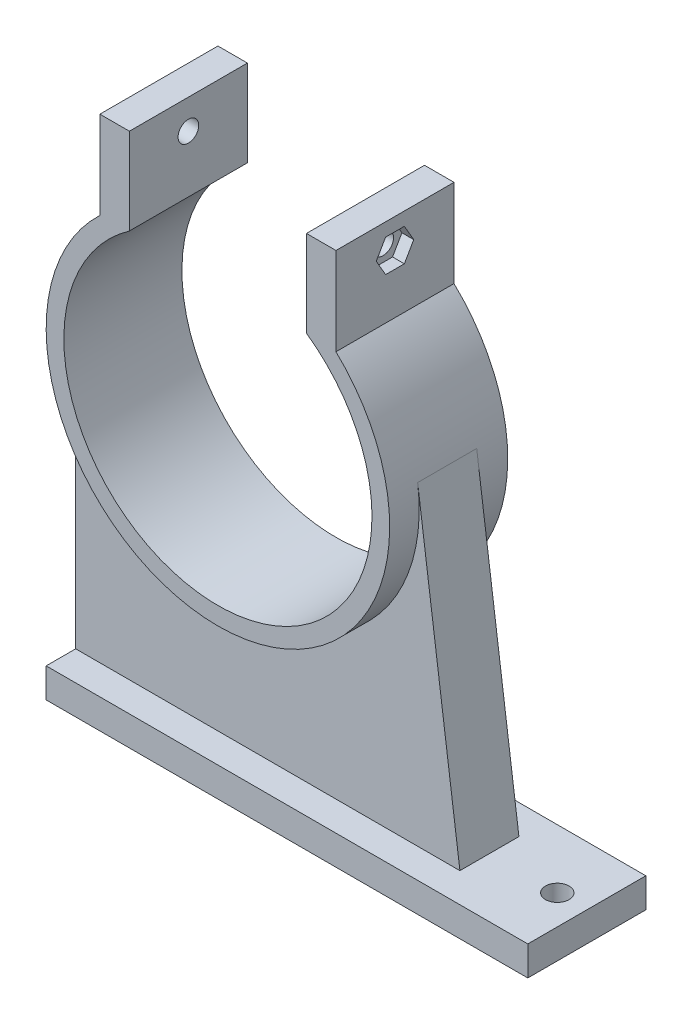
from build123d import *
from build123d.topology import SkipClean

# Parameters (mm, degrees)
SCHIZZO1_R                   = 29.1
SCHIZZO1_R_2                 = 26.1
ESTRUSIONE_ESTRUSIONE1_DEPTH = 20
SCHIZZO2_W                   = 5
SCHIZZO2_H                   = 17.200297627
ESTRUSIONE_ESTRUSIONE2_DEPTH = 20
SCHIZZO3_W                   = 30
SCHIZZO3_H                   = 16.910350343
TAGLIO_ESTRUSIONE1_DEPTH     = 51.426282829
TAGLIO_ESTRUSIONE3_DEPTH     = 51.426282829
SCHIZZO5_R                   = 1.75
TAGLIO_ESTRUSIONE4_DEPTH     = 65.084397477
SCHIZZO6_R                   = 3.25
TAGLIO_ESTRUSIONE5_DEPTH     = 2
TAGLIO_ESTRUSIONE6_DEPTH     = 2
ESTRUSIONE_ESTRUSIONE3_START = -5
ESTRUSIONE_ESTRUSIONE3_DEPTH = 10
ESTRUSIONE_ESTRUSIONE4_START = 5
SCHIZZO10_W                  = 81.6
SCHIZZO10_H                  = 5
ESTRUSIONE_ESTRUSIONE4_DEPTH = 20
SCHIZZO9_R                   = 2
TAGLIO_ESTRUSIONE7_DEPTH     = 103.305913808


with BuildPart() as part:
    # Schizzo1 → Estrusione-Estrusione1 (new body)
    with BuildSketch(Plane.XY):
        Circle(SCHIZZO1_R)
        Circle(SCHIZZO1_R_2, mode=Mode.SUBTRACT)
    extrude(amount=ESTRUSIONE_ESTRUSIONE1_DEPTH)

    # Schizzo2 → Estrusione-Estrusione2 (add)
    with BuildSketch(Plane.XY.offset(20)):
        with Locations((-17.5, 27.399851187)):
            Rectangle(SCHIZZO2_W, SCHIZZO2_H)
        with Locations((17.5, 27.399851187)):
            Rectangle(SCHIZZO2_W, SCHIZZO2_H)
    extrude(amount=-ESTRUSIONE_ESTRUSIONE2_DEPTH)

    # Schizzo3 → Taglio-Estrusione1 (cut, through all)
    with BuildSketch(Plane.XY.offset(20)):
        with Locations((0, 27.544824829)):
            Rectangle(SCHIZZO3_W, SCHIZZO3_H)
    extrude(amount=-TAGLIO_ESTRUSIONE1_DEPTH, mode=Mode.SUBTRACT)

    # Schizzo4 → Taglio-Estrusione3 (cut, through all)
    with SkipClean():  # the faces are left unmerged after this step: merging them gives an invalid solid
        with BuildSketch(Plane.XY.offset(20)):
            with BuildLine():
                Line((-15, 18.799702373), (-18.104728407, 18.799702373))
                ThreePointArc((-18.104728407, 18.799702373), (-10.214611803, -24.01815367), (26.1, 0))
                ThreePointArc((26.1, 0), (24.01815367, 10.214611803), (18.104728407, 18.799702373))
                Line((18.104728407, 18.799702373), (15, 18.799702373))
                Line((15, 18.799702373), (15, 21.359073014))
                ThreePointArc((15, 21.359073014), (0, 26.1), (-15, 21.359073014))
                Line((-15, 21.359073014), (-15, 18.799702373))
            make_face()
            with BuildLine():
                ThreePointArc((-15, 21.359073014), (-16.601757595, 20.139305965), (-18.104728407, 18.799702373))
                Line((-18.104728407, 18.799702373), (-15, 18.799702373))
                Line((-15, 18.799702373), (-15, 21.359073014))
            make_face()
            with BuildLine():
                Line((15, 18.799702373), (18.104728407, 18.799702373))
                ThreePointArc((18.104728407, 18.799702373), (16.601757595, 20.139305965), (15, 21.359073014))
                Line((15, 21.359073014), (15, 18.799702373))
            make_face()
        extrude(amount=-TAGLIO_ESTRUSIONE3_DEPTH, mode=Mode.SUBTRACT)

    # Schizzo5 → Taglio-Estrusione4 (cut, through all)
    with SkipClean():  # the faces are left unmerged after this step: merging them gives an invalid solid
        with BuildSketch(Plane.ZY.offset(20)):
            with Locations((10, 31)):
                Circle(SCHIZZO5_R)
        extrude(amount=-TAGLIO_ESTRUSIONE4_DEPTH, mode=Mode.SUBTRACT)

    # Schizzo6 → Taglio-Estrusione5 (cut)
    with SkipClean():  # the faces are left unmerged after this step: merging them gives an invalid solid
        with BuildSketch(Plane.ZY.offset(20)):
            with Locations((10, 31)):
                Circle(SCHIZZO6_R)
        extrude(amount=-TAGLIO_ESTRUSIONE5_DEPTH, mode=Mode.SUBTRACT)

    # Schizzo7 → Taglio-Estrusione6 (cut)
    with SkipClean():  # the faces are left unmerged after this step: merging them gives an invalid solid
        with BuildSketch(Plane(origin=(20, 0, 0), x_dir=(0, 0, -1), z_dir=(1, 0, 0))):
            Polygon((-8.41228676, 28.25), (-6.824573519, 31), (-8.41228676, 33.75), (-11.58771324, 33.75), (-13.175426481, 31), (-11.58771324, 28.25), align=None)
        extrude(amount=-TAGLIO_ESTRUSIONE6_DEPTH, mode=Mode.SUBTRACT)

    # Schizzo8 → Estrusione-Estrusione3 (add)
    with SkipClean():  # the faces are left unmerged after this step: merging them gives an invalid solid
        with BuildSketch(Plane(origin=(0, 0, 0), x_dir=(-1, 0, 0), z_dir=(0, 0, -1)).offset(ESTRUSIONE_ESTRUSIONE3_START)):
            with BuildLine():
                Line((-52.5, -49.5), (-52.5, -54.5))
                Line((-52.5, -54.5), (29.1, -54.5))
                Line((29.1, -54.5), (29.1, 0))
                ThreePointArc((29.1, 0), (-1.93856651, -29.035357065), (-28.841715456, 3.868520332))
                Line((-28.841715456, 3.868520332), (-36, -49.5))
                Line((-36, -49.5), (-52.5, -49.5))
            make_face()
            with BuildLine():
                ThreePointArc((-28.841715456, 3.868520332), (-1.93856651, -29.035357065), (29.1, 0))
                Line((29.1, 0), (26.099231032, 0.2003485))
                ThreePointArc((26.099231032, 0.2003485), (-1.738714293, -26.042021285), (-25.840946488, 3.668171832))
                Line((-25.840946488, 3.668171832), (-28.841715456, 3.868520332))
            make_face()
        extrude(amount=-ESTRUSIONE_ESTRUSIONE3_DEPTH)

    # Schizzo10 → Estrusione-Estrusione4 (add)
    with SkipClean():  # the faces are left unmerged after this step: merging them gives an invalid solid
        with BuildSketch(Plane(origin=(0, 0, 5), x_dir=(-1, 0, 0), z_dir=(0, 0, -1)).offset(ESTRUSIONE_ESTRUSIONE4_START)):
            with Locations((-11.7, -52)):
                Rectangle(SCHIZZO10_W, SCHIZZO10_H)
        extrude(amount=-ESTRUSIONE_ESTRUSIONE4_DEPTH)

    # Schizzo9 → Taglio-Estrusione7 (cut, through all)
    with SkipClean():  # the faces are left unmerged after this step: merging them gives an invalid solid
        with BuildSketch(Plane(origin=(0, -49.5, 0), x_dir=(1, 0, 0), z_dir=(0, 1, 0))):
            with Locations(Location((47.5, -10, 0), (0, 0, 270))):
                Circle(SCHIZZO9_R)
        extrude(amount=-TAGLIO_ESTRUSIONE7_DEPTH, mode=Mode.SUBTRACT)


solid = part.part
